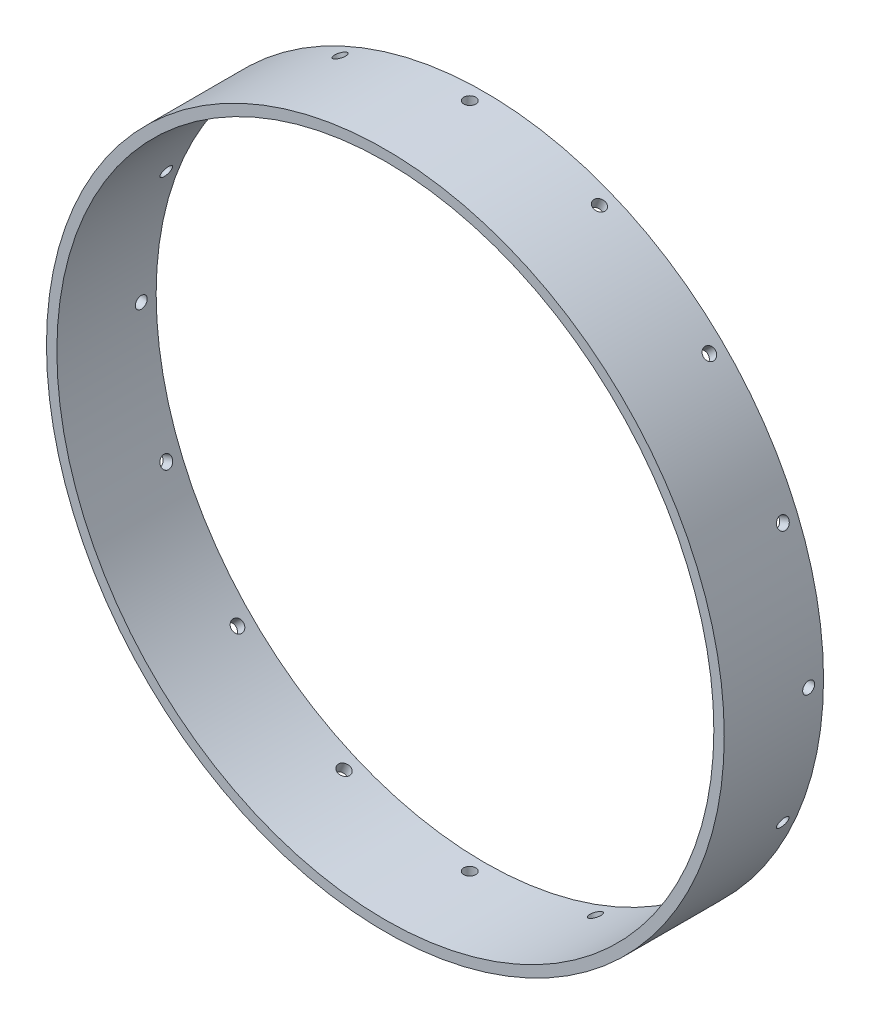
from build123d import *

# Parameters (mm, degrees)
SKETCH1_R           = 136.525
SKETCH1_R_2         = 132.334
BOSS_EXTRUDE1_DEPTH = 40
SKETCH2_R           = 2.413
CUT_EXTRUDE1_DEPTH  = 198.175432674
CIRPATTERN1_COUNT   = 16


with BuildPart() as part:
    # Sketch1 → Boss-Extrude1 (new body)
    with BuildSketch(Plane(origin=(0, 0, 0), x_dir=(0, 1, 0), z_dir=(0, 0, 1))):
        with Locations(Location((0, 0, 0), (0, 0, 270))):
            Circle(SKETCH1_R)
        with Locations(Location((0, 0, 0), (0, 0, 270))):
            Circle(SKETCH1_R_2, mode=Mode.SUBTRACT)
    extrude(amount=BOSS_EXTRUDE1_DEPTH)

    # Sketch2 → Cut-Extrude1 (cut, through all)
    with BuildSketch(Plane.YZ):
        with Locations(Location((0, 6, 0), (0, 0, 90))):
            Circle(SKETCH2_R)
    cut_extrude1 = extrude(amount=CUT_EXTRUDE1_DEPTH, mode=Mode.SUBTRACT)

    # CirPattern1: Cut-Extrude1 ×16 about axis
    cirpattern1_axis = Axis((0, 0, 40), (0, 0, -1))
    for i in range(1, CIRPATTERN1_COUNT):
        add(cut_extrude1.rotate(cirpattern1_axis, i * 360 / CIRPATTERN1_COUNT), mode=Mode.SUBTRACT)


solid = part.part
